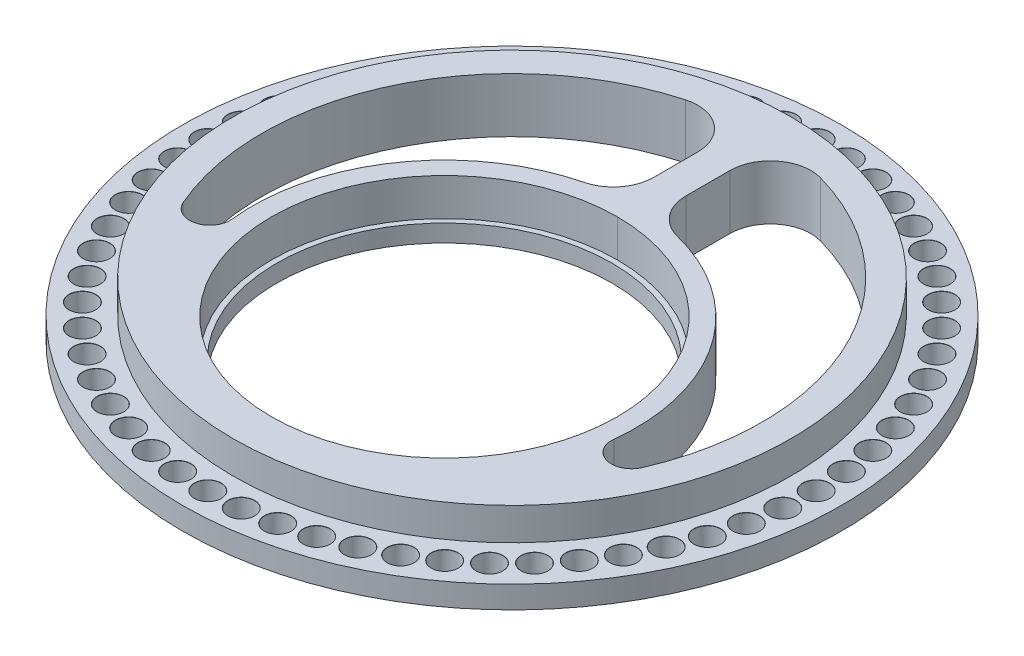
from build123d import *

# Parameters (mm, degrees)
SKETCH1_R                  = 61.9125
SKETCH1_R_2                = 30.988
SLOTTED_BODY_EXTRUDE_DEPTH = 4.191
SKETCH5_R                  = 52.3875
BOSS_EXTRUDE3_DEPTH        = 6.080000032
SKETCH6_R                  = 32.512
CUT_EXTRUDE5_DEPTH         = 89.157862691
SKETCH8_R                  = 32.512
SKETCH8_R_2                = 31.496
BOSS_EXTRUDE4_DEPTH        = 3.255000094
CIRPATTERN1_COUNT          = 60


with BuildPart() as part:
    # Sketch1 → Slotted-Body Extrude (new body)
    with BuildSketch(Plane(origin=(0, 0, 0), x_dir=(1, 0, 0), z_dir=(0, 1, 0))):
        with Locations(Location((0, 0, 0), (0, 0, 270))):
            Circle(SKETCH1_R)
        with Locations(Location((0, -12.7, 0), (0, 0, 270))):
            Circle(SKETCH1_R_2, mode=Mode.SUBTRACT)
    extrude(amount=SLOTTED_BODY_EXTRUDE_DEPTH)

    # Sketch5 → Boss-Extrude3 (add)
    with BuildSketch(Plane(origin=(0, 4.191, 0), x_dir=(1, 0, 0), z_dir=(0, 1, 0))):
        with Locations(Location((0, 0, 0), (0, 0, 270))):
            Circle(SKETCH5_R)
    extrude(amount=BOSS_EXTRUDE3_DEPTH)

    # Sketch6 → Cut-Extrude5 (cut, through all)
    with BuildSketch(Plane.XZ):
        with Locations(Location((0, 12.7, 0), (0, 0, 270))):
            Circle(SKETCH6_R)
        with BuildLine():
            Line((3.013951015, -37.906674687), (3.013951015, -29.674053734))
            ThreePointArc((3.013951015, -29.674053734), (4.62572071, -24.987309811), (8.779192117, -22.283230408))
            ThreePointArc((8.779192117, -22.283230408), (29.633571529, -7.860935349), (35.842979594, 16.722615796))
            ThreePointArc((35.842979594, 16.722615796), (38.649483906, 20.829419562), (43.125904818, 18.660558235))
            ThreePointArc((43.125904818, 18.660558235), (42.424568065, -20.204359046), (12.692135082, -45.243450433))
            ThreePointArc((12.692135082, -45.243450433), (6.03063496, -43.979061474), (3.013951015, -37.906674687))
        make_face()
        with BuildLine():
            Line((-3.013951015, -37.906674687), (-3.013951015, -29.674053734))
            ThreePointArc((-3.013951015, -29.674053734), (-4.62572071, -24.987309811), (-8.779192117, -22.283230408))
            ThreePointArc((-8.779192117, -22.283230408), (-29.633571529, -7.860935349), (-35.842979594, 16.722615796))
            ThreePointArc((-35.842979594, 16.722615796), (-38.649483906, 20.829419562), (-43.125904818, 18.660558235))
            ThreePointArc((-43.125904818, 18.660558235), (-42.424568065, -20.204359046), (-12.692135082, -45.243450433))
            ThreePointArc((-12.692135082, -45.243450433), (-6.03063496, -43.979061474), (-3.013951015, -37.906674687))
        make_face()
    extrude(amount=-CUT_EXTRUDE5_DEPTH, mode=Mode.SUBTRACT)

    # Sketch10 → Ø5.0mm Dowel Hole1 (revolve, cut)
    with BuildSketch(Plane(origin=(0, 4.191, -57.15), x_dir=(0, 0, 1), z_dir=(1, 0, 0))):
        Polygon((0, 0), (0, 4.191), (2.5, 4.191), (2.5, 0.025), (2.525, 0), align=None)
    f_5_0mm_dowel_hole1 = revolve(axis=Axis((0, 10.541, -57.15), (0, -1, 0)), mode=Mode.SUBTRACT)

    # CirPattern1: Ø5.0mm Dowel Hole1 ×60 about axis
    cirpattern1_axis = Axis((0, 0, 0), (0, 1, 0))
    for i in range(1, CIRPATTERN1_COUNT):
        add(f_5_0mm_dowel_hole1.rotate(cirpattern1_axis, i * 360 / CIRPATTERN1_COUNT), mode=Mode.SUBTRACT)


with BuildPart() as body_2:
    # Sketch8 → Boss-Extrude4 (new body)
    with BuildSketch(Plane.XZ):
        with Locations(Location((0, 12.7, 0), (0, 0, 270))):
            Circle(SKETCH8_R)
        with Locations(Location((0, 12.7, 0), (0, 0, 270))):
            Circle(SKETCH8_R_2, mode=Mode.SUBTRACT)
    extrude(amount=-BOSS_EXTRUDE4_DEPTH)


solid = Compound([part.part, body_2.part])
